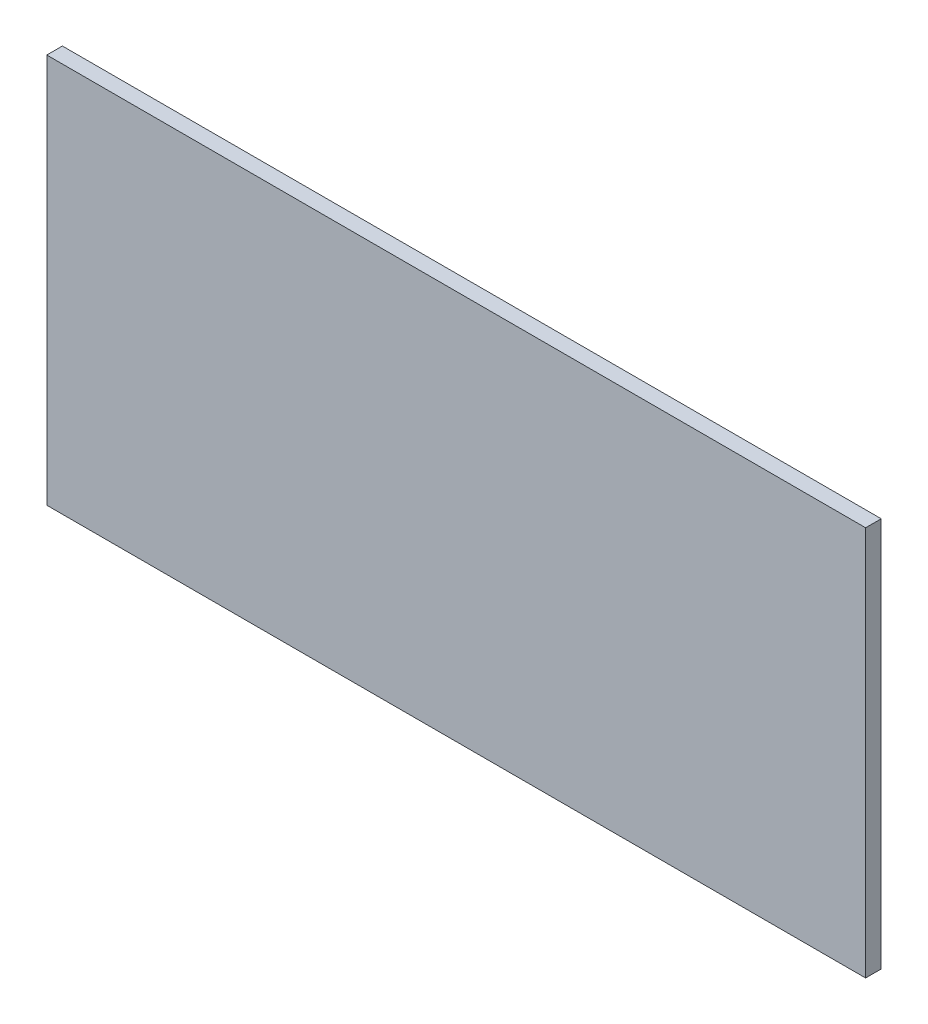
from build123d import *

# Parameters (mm, degrees)
SKETCH_1_W      = 105
SKETCH_1_H      = 50
EXTRUDE_1_DEPTH = 2


with BuildPart() as part:
    # 草图1 → 凸台-拉伸1 (new body)
    with BuildSketch(Plane.XY):
        with Locations((72.5, 0)):
            Rectangle(SKETCH_1_W, SKETCH_1_H)
    extrude(amount=EXTRUDE_1_DEPTH)


solid = part.part
